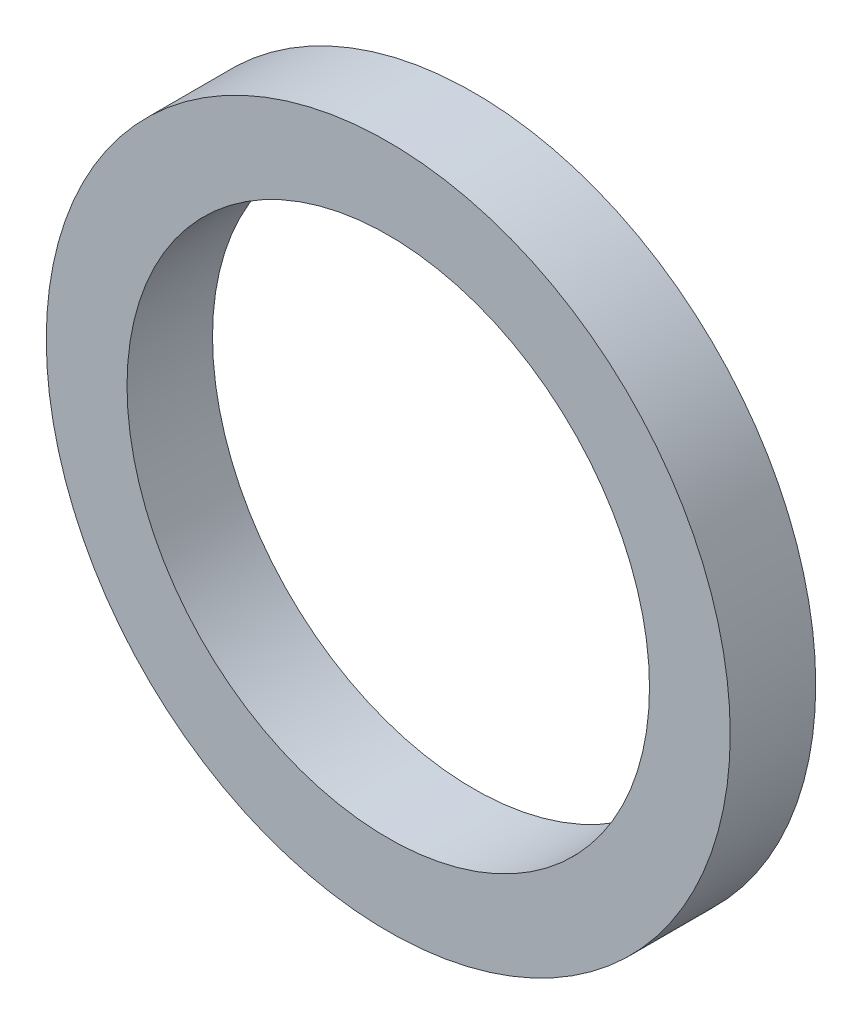
from build123d import *

# Parameters (mm, degrees)
SKETCH_1_R      = 36
SKETCH_1_R_2    = 27.5
EXTRUDE_1_DEPTH = 9


with BuildPart() as part:
    # Эскиз1 → Бобышка-Вытянуть1 (new body)
    with BuildSketch(Plane.XY):
        Circle(SKETCH_1_R)
        Circle(SKETCH_1_R_2, mode=Mode.SUBTRACT)
    extrude(amount=EXTRUDE_1_DEPTH)


solid = part.part
